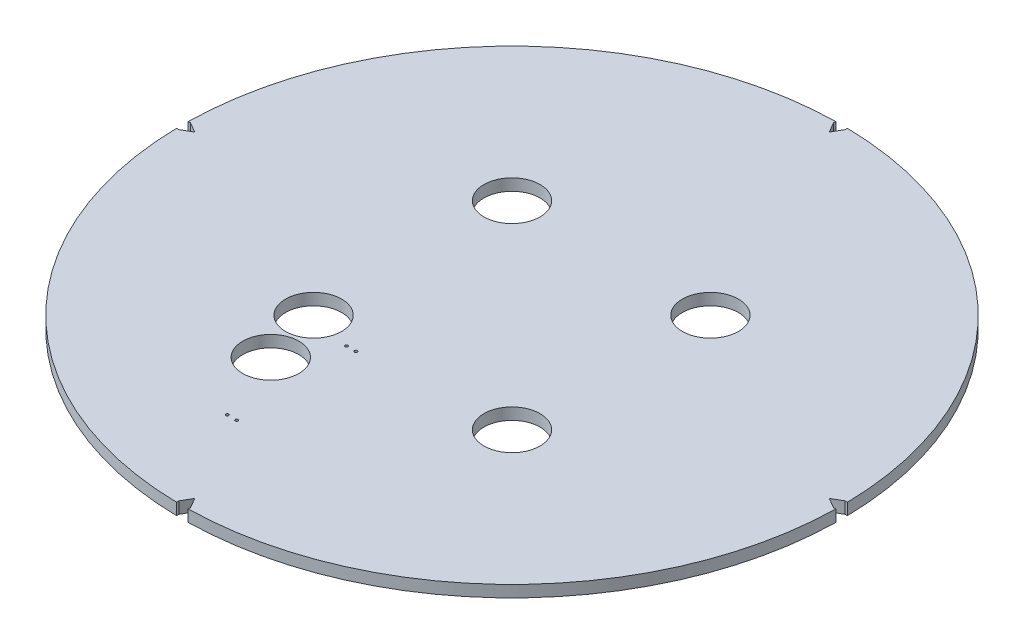
from build123d import *

# Parameters (mm, degrees)
SKETCH_1_R               = 705
EXTRUDE_1_DEPTH          = 25
CUT_EXTRUDE_1_REACH      = 999.334
PATTERN_CIRCULAR_1_COUNT = 4
CUT_EXTRUDE_2_REACH      = 999.177
SKETCH_8_R               = 60
SKETCH_11_R              = 60
CUT_EXTRUDE_3_DEPTH      = 100
SKETCH_12_R              = 60
EXTRUDE_2_DEPTH          = 25
SKETCH_13_R              = 60
CUT_EXTRUDE_4_DEPTH      = 998.177266087
SKETCH_15_R              = 3
CUT_EXTRUDE_5_DEPTH      = 998.177266087


with BuildPart() as part:
    # 草图1 → 凸台-拉伸1 (new body)
    with BuildSketch(Plane(origin=(0, 0, 0), x_dir=(1, 0, 0), z_dir=(0, 1, 0))):
        with Locations(Location((0, 0, 0), (0, 0, 270))):
            Circle(SKETCH_1_R)
    extrude(amount=EXTRUDE_1_DEPTH)

    # 草图2 → 切除-拉伸1 (cut, up to next)
    with BuildSketch(Plane(origin=(0, 25, 0), x_dir=(1, 0, 0), z_dir=(0, 1, 0)), mode=Mode.PRIVATE) as cut_extrude_1_sk1:
        with BuildLine():
            Line((-12.5, -699.994189271), (-12.5, -704.889175687))
            ThreePointArc((-12.5, -704.889175687), (0, -705), (12.5, -704.889175687))
            Line((12.5, -704.889175687), (12.5, -699.994189271))
            Line((12.5, -699.994189271), (0, -678.343554177))
            Line((0, -678.343554177), (-12.5, -699.994189271))
        make_face()
    cut_extrude_1_tool1 = extrude(cut_extrude_1_sk1.sketch, amount=-CUT_EXTRUDE_1_REACH, mode=Mode.PRIVATE) & part.part
    cut_extrude_1 = cut_extrude_1_tool1.solids().sort_by_distance((0, 25, 695.82939))[0]
    add(cut_extrude_1, mode=Mode.SUBTRACT)

    # 阵列(圆周)1: 切除-拉伸1 ×4 about axis
    pattern_circular_1_axis = Axis((0, 0, 0), (0, 1, 0))
    for i in range(1, PATTERN_CIRCULAR_1_COUNT):
        add(cut_extrude_1.rotate(pattern_circular_1_axis, i * 360 / PATTERN_CIRCULAR_1_COUNT), mode=Mode.SUBTRACT)

    # 草图8 → 切除-拉伸2 (cut, up to next)
    with BuildSketch(Plane(origin=(0, 25, 0), x_dir=(1, 0, 0), z_dir=(0, 1, 0)), mode=Mode.PRIVATE) as cut_extrude_2_sk1:
        with Locations(Location((212.132034356, -212.132034356, 0), (0, 0, 270))):
            Circle(SKETCH_8_R)
    cut_extrude_2_tool1 = extrude(cut_extrude_2_sk1.sketch, amount=-CUT_EXTRUDE_2_REACH, mode=Mode.PRIVATE) & part.part
    # 草图8 → 切除-拉伸2 (cut, up to next)
    with BuildSketch(Plane(origin=(0, 25, 0), x_dir=(1, 0, 0), z_dir=(0, 1, 0)), mode=Mode.PRIVATE) as cut_extrude_2_sk2:
        with Locations(Location((-212.132034356, -212.132034356, 0), (0, 0, 270))):
            Circle(SKETCH_8_R)
    cut_extrude_2_tool2 = extrude(cut_extrude_2_sk2.sketch, amount=-CUT_EXTRUDE_2_REACH, mode=Mode.PRIVATE) & part.part
    # 草图8 → 切除-拉伸2 (cut, up to next)
    with BuildSketch(Plane(origin=(0, 25, 0), x_dir=(1, 0, 0), z_dir=(0, 1, 0)), mode=Mode.PRIVATE) as cut_extrude_2_sk3:
        with Locations(Location((-212.132034356, 212.132034356, 0), (0, 0, 270))):
            Circle(SKETCH_8_R)
    cut_extrude_2_tool3 = extrude(cut_extrude_2_sk3.sketch, amount=-CUT_EXTRUDE_2_REACH, mode=Mode.PRIVATE) & part.part
    # 草图8 → 切除-拉伸2 (cut, up to next)
    with BuildSketch(Plane(origin=(0, 25, 0), x_dir=(1, 0, 0), z_dir=(0, 1, 0)), mode=Mode.PRIVATE) as cut_extrude_2_sk4:
        with Locations(Location((212.132034356, 212.132034356, 0), (0, 0, 270))):
            Circle(SKETCH_8_R)
    cut_extrude_2_tool4 = extrude(cut_extrude_2_sk4.sketch, amount=-CUT_EXTRUDE_2_REACH, mode=Mode.PRIVATE) & part.part
    add(cut_extrude_2_tool1.solids().sort_by_distance((212.132034, 25, 212.132034))[0], mode=Mode.SUBTRACT)
    add(cut_extrude_2_tool2.solids().sort_by_distance((-212.132034, 25, 212.132034))[0], mode=Mode.SUBTRACT)
    add(cut_extrude_2_tool3.solids().sort_by_distance((-212.132034, 25, -212.132034))[0], mode=Mode.SUBTRACT)
    add(cut_extrude_2_tool4.solids().sort_by_distance((212.132034, 25, -212.132034))[0], mode=Mode.SUBTRACT)

    # 草图11 → 切除-拉伸3 (cut)
    with BuildSketch(Plane(origin=(0, 25, 0), x_dir=(1, 0, 0), z_dir=(0, 1, 0))):
        with Locations(Location((-73.369984345, -151.389388343, 0), (0, 0, 270))):
            Circle(SKETCH_11_R)
    extrude(amount=-CUT_EXTRUDE_3_DEPTH, mode=Mode.SUBTRACT)

    # 草图12 → 凸台-拉伸2 (add)
    with BuildSketch(Plane(origin=(0, 25, 0), x_dir=(1, 0, 0), z_dir=(0, 1, 0))):
        with Locations((-73.369984345, -151.389388343)):
            Circle(SKETCH_12_R)
    extrude(amount=-EXTRUDE_2_DEPTH)

    # 草图13 → 切除-拉伸4 (cut, through all)
    with BuildSketch(Plane(origin=(0, 25, 0), x_dir=(1, 0, 0), z_dir=(0, 1, 0))):
        with Locations(Location((-179.993569405, -335.765285362, 0), (0, 0, 270))):
            Circle(SKETCH_13_R)
    extrude(amount=-CUT_EXTRUDE_4_DEPTH, mode=Mode.SUBTRACT)

    # 草图15 → 切除-拉伸5 (cut, through all)
    with BuildSketch(Plane(origin=(0, 25, 0), x_dir=(1, 0, 0), z_dir=(0, 1, 0))):
        with Locations(Location((-99.993569405, -233.765285362, 0), (0, 0, 270))):
            Circle(SKETCH_15_R)
        with Locations(Location((-99.993569405, -488.765285362, 0), (0, 0, 270))):
            Circle(SKETCH_15_R)
        with Locations(Location((-119.993569405, -233.765285362, 0), (0, 0, 270))):
            Circle(SKETCH_15_R)
        with Locations(Location((-119.993569405, -488.765285362, 0), (0, 0, 270))):
            Circle(SKETCH_15_R)
    extrude(amount=-CUT_EXTRUDE_5_DEPTH, mode=Mode.SUBTRACT)


solid = part.part
